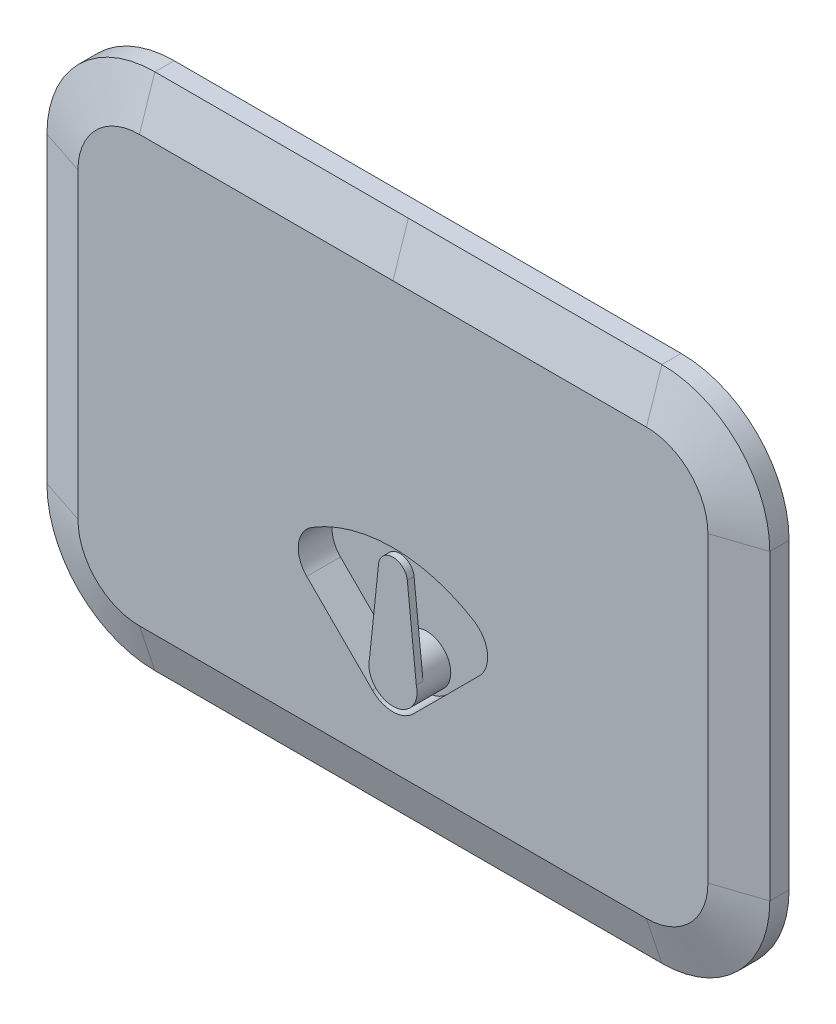
from build123d import *

# Parameters (mm, degrees)
BOSS_EXTRUDE1_DEPTH = 18
BOSS_EXTRUDE2_DEPTH = 24.5
CUT_EXTRUDE1_DEPTH  = 17.5
SKETCH6_R           = 12.5
BOSS_EXTRUDE3_DEPTH = 14
BOSS_EXTRUDE4_DEPTH = 3.5
CUT_EXTRUDE6_DEPTH  = 23.5


with BuildPart() as part:
    # Sketch1 → Boss-Extrude1 (new body)
    with BuildSketch(Plane.XY):
        with BuildLine():
            Line((-131.5, -134.5), (131.5, -134.5))
            ThreePointArc((131.5, -134.5), (171.097979746, -118.097979746), (187.5, -78.5))
            Line((187.5, -78.5), (187.5, 78.5))
            ThreePointArc((187.5, 78.5), (171.097979746, 118.097979746), (131.5, 134.5))
            Line((131.5, 134.5), (-131.5, 134.5))
            ThreePointArc((-131.5, 134.5), (-171.097979746, 118.097979746), (-187.5, 78.5))
            Line((-187.5, 78.5), (-187.5, -78.5))
            ThreePointArc((-187.5, -78.5), (-171.097979746, -118.097979746), (-131.5, -134.5))
        make_face()
    extrude(amount=BOSS_EXTRUDE1_DEPTH)

    # Cut-Sweep1: sweep along a path in Sketch3
    with BuildLine(Plane.XY.offset(18)) as cut_sweep1_path:
        Line((131.5, 134.5), (-131.5, 134.5))
        ThreePointArc((-131.5, 134.5), (-171.097979746, 118.097979746), (-187.5, 78.5))
        Line((-187.5, 78.5), (-187.5, -78.5))
        ThreePointArc((-187.5, -78.5), (-171.097979746, -118.097979746), (-131.5, -134.5))
        Line((-131.5, -134.5), (131.5, -134.5))
        ThreePointArc((131.5, -134.5), (171.097979746, -118.097979746), (187.5, -78.5))
        Line((187.5, -78.5), (187.5, 78.5))
        ThreePointArc((187.5, 78.5), (171.097979746, 118.097979746), (131.5, 134.5))
    # Sketch2 → Cut-Sweep1 (sweep, cut)
    with BuildSketch(Plane(origin=(0, 0, 0), x_dir=(0, 0, -1), z_dir=(1, 0, 0))):
        Polygon((-18, 110.392739683), (-10, 134.5), (-18, 134.5), align=None)
    sweep(path=cut_sweep1_path.line, mode=Mode.SUBTRACT)

    # Sketch4 → Boss-Extrude2 (add)
    with BuildSketch(Plane(origin=(0, 0, 0), x_dir=(-1, 0, 0), z_dir=(0, 0, -1))):
        with BuildLine():
            Line((113.5, 96), (-113.5, 96))
            ThreePointArc((-113.5, 96), (-136.127416998, 86.627416998), (-145.5, 64))
            Line((-145.5, 64), (-145.5, -64))
            ThreePointArc((-145.5, -64), (-136.127416998, -86.627416998), (-113.5, -96))
            Line((-113.5, -96), (113.5, -96))
            ThreePointArc((113.5, -96), (136.127416998, -86.627416998), (145.5, -64))
            Line((145.5, -64), (145.5, 64))
            ThreePointArc((145.5, 64), (136.127416998, 86.627416998), (113.5, 96))
        make_face()
    extrude(amount=BOSS_EXTRUDE2_DEPTH)

    # Sketch5 → Cut-Extrude1 (cut)
    with BuildSketch(Plane.XY.offset(18)):
        with BuildLine():
            Line((10.606601718, -78.893398282), (44.72135955, -44.77864045))
            ThreePointArc((44.72135955, -44.77864045), (49.01319592, -32.429470934), (41.987394255, -21.40404767))
            ThreePointArc((41.987394255, -21.40404767), (0, -9.5), (-41.987394255, -21.40404767))
            ThreePointArc((-41.987394255, -21.40404767), (-49.01319592, -32.429470934), (-44.72135955, -44.77864045))
            Line((-44.72135955, -44.77864045), (-10.606601718, -78.893398282))
            ThreePointArc((-10.606601718, -78.893398282), (0, -83.286796564), (10.606601718, -78.893398282))
        make_face()
    extrude(amount=-CUT_EXTRUDE1_DEPTH, mode=Mode.SUBTRACT)

    # Sketch6 → Boss-Extrude3 (add)
    with BuildSketch(Plane.XY.offset(0.5)):
        with Locations((0, -68.286796564)):
            Circle(SKETCH6_R)
    extrude(amount=BOSS_EXTRUDE3_DEPTH)

    # Sketch7 → Boss-Extrude4 (add)
    with BuildSketch(Plane.XY.offset(14.5)):
        with BuildLine():
            Line((-7.459505989, -20.508484033), (-12.129381177, -65.265519969))
            ThreePointArc((-12.129381177, -65.265519969), (0, -80.786796564), (12.129381177, -65.265519969))
            Line((12.129381177, -65.265519969), (7.459505989, -20.508484033))
            ThreePointArc((7.459505989, -20.508484033), (0, -13.786796564), (-7.459505989, -20.508484033))
        make_face()
    extrude(amount=BOSS_EXTRUDE4_DEPTH)

    # Sketch9 → Cut-Extrude6 (cut)
    with BuildSketch(Plane(origin=(0, 0, -24.5), x_dir=(-1, 0, 0), z_dir=(0, 0, -1))):
        with BuildLine():
            Line((113.5, 92.55), (-113.5, 92.55))
            ThreePointArc((-113.5, 92.55), (-133.687898603, 84.187898603), (-142.05, 64))
            Line((-142.05, 64), (-142.05, -64))
            ThreePointArc((-142.05, -64), (-133.687898603, -84.187898603), (-113.5, -92.55))
            Line((-113.5, -92.55), (113.5, -92.55))
            ThreePointArc((113.5, -92.55), (133.687898603, -84.187898603), (142.05, -64))
            Line((142.05, -64), (142.05, 64))
            ThreePointArc((142.05, 64), (133.687898603, 84.187898603), (113.5, 92.55))
        make_face()
    extrude(amount=-CUT_EXTRUDE6_DEPTH, mode=Mode.SUBTRACT)


solid = part.part
